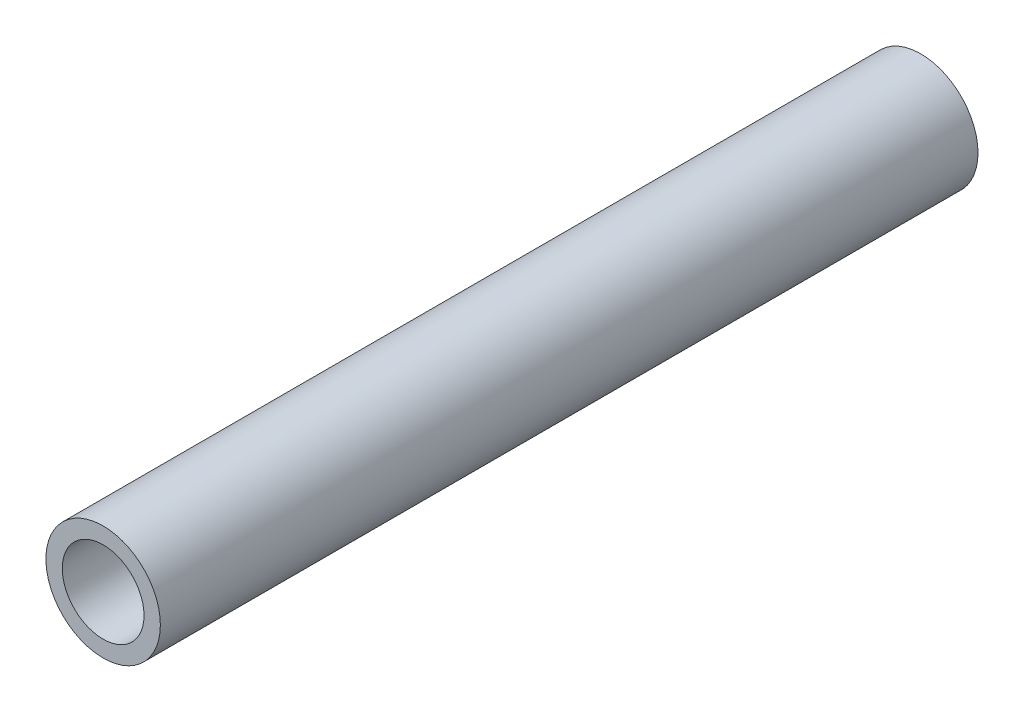
from build123d import *

# Parameters (mm, degrees)
ESQUISSE1_R        = 3.5
ESQUISSE1_R_2      = 2.5
BOSS_EXTRU_1_DEPTH = 50


with BuildPart() as part:
    # Esquisse1 → Boss.-Extru.1 (new body)
    with BuildSketch(Plane.XY):
        Circle(ESQUISSE1_R)
        Circle(ESQUISSE1_R_2, mode=Mode.SUBTRACT)
    extrude(amount=BOSS_EXTRU_1_DEPTH)


solid = part.part
